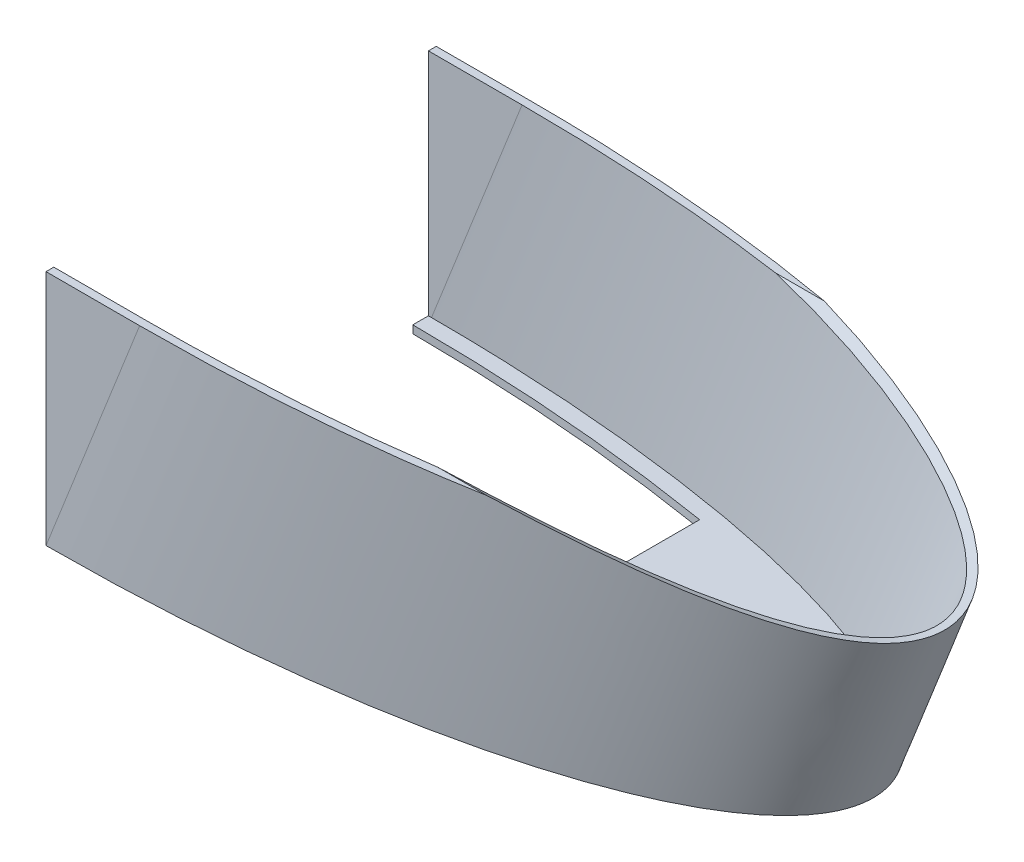
from build123d import *

# Parameters (mm, degrees)
BOSS_EXTRUDE1_DEPTH                               = 1.5875
BOSS_EXTRUDE3_DEPTH                               = 1.5875
SKETCH8_R                                         = 57.15
CUT_EXTRUDE2_DEPTH                                = 332.381489744
CSK_FOR_6_FLAT_HEAD_SOCKET_CAP_SCREW1_D           = 3.7973
CSK_FOR_6_FLAT_HEAD_SOCKET_CAP_SCREW1_DEPTH       = 25.4
CSK_FOR_6_FLAT_HEAD_SOCKET_CAP_SCREW1_CSINK_D     = 7.7978
CSK_FOR_6_FLAT_HEAD_SOCKET_CAP_SCREW1_CSINK_ANGLE = 82
CSK_FOR_6_FLAT_HEAD_SOCKET_CAP_SCREW1_TIP         = 1.140824014


with BuildPart() as part:
    # Sketch2 → Boss-Extrude1 (new body)
    with BuildSketch(Plane(origin=(0, 0, 0), x_dir=(1, 0, 0), z_dir=(0, 1, 0))):
        with BuildLine():
            Line((177.8, 39.6875), (177.8, 34.925))
            ThreePointArc((177.8, 34.925), (209.65434478, 33.634789273), (241.3, 29.772609736))
            Line((241.3, 29.772609736), (241.3, -29.772609736))
            ThreePointArc((241.3, -29.772609736), (209.65434478, -33.634789273), (177.8, -34.925))
            Line((177.8, -34.925), (177.8, -39.6875))
            add(Edge.make_bspline(
                [(177.8, -39.6875), (186.143301052, -39.6875), (194.486387917, -39.441008444), (210.855681467, -38.464191965), (218.88146348, -37.733902814), (234.311655445, -35.816484379), (241.715649009, -34.629439064), (255.6232166, -31.841617193), (262.126380598, -30.241021205), (273.99107136, -26.681613977), (279.352224254, -24.723261918), (288.741511951, -20.507643295), (292.76990648, -18.251659724), (299.357876202, -13.480229969), (301.923000051, -10.964368167), (304.562730244, -6.983122211), (305.240156115, -5.62041101), (306.153353808, -2.838855477), (306.3875, -1.419988971), (306.3875, 1.419988971), (306.153353808, 2.838855477), (305.240156115, 5.62041101), (304.562730244, 6.983122211), (301.923000051, 10.964368167), (299.357876202, 13.480229969), (292.76990648, 18.251659724), (288.741511951, 20.507643295), (279.352224254, 24.723261918), (273.99107136, 26.681613977), (262.126380598, 30.241021205), (255.6232166, 31.841617193), (241.715649009, 34.629439064), (234.311655445, 35.816484379), (218.88146348, 37.733902814), (210.855681467, 38.464191965), (194.486387917, 39.441008444), (186.143301052, 39.6875), (177.8, 39.6875)],
                knots=[0, 0, 0, 0, 0.0625, 0.0625, 0.125, 0.125, 0.1875, 0.1875, 0.25, 0.25, 0.3125, 0.3125, 0.375, 0.375, 0.4375, 0.4375, 0.46875, 0.46875, 0.5, 0.5, 0.53125, 0.53125, 0.5625, 0.5625, 0.625, 0.625, 0.6875, 0.6875, 0.75, 0.75, 0.8125, 0.8125, 0.875, 0.875, 0.9375, 0.9375, 1, 1, 1, 1], degree=3))
        make_face()
    extrude(amount=BOSS_EXTRUDE1_DEPTH)

    # Sweep1: sweep along a path in Sketch5
    with BuildLine(Plane.XY) as sweep1_path:
        Line((306.3875, 0), (325.4375, 48.26))
    # Sketch4 → Sweep1 (sweep)
    with BuildSketch(Plane(origin=(0, 0, 0), x_dir=(1, 0, 0), z_dir=(0, 1, 0))):
        with BuildLine():
            Line((177.8, 38.1), (177.8, 39.6875))
            add(Edge.make_bspline(
                [(177.8, -39.6875), (186.143301052, -39.6875), (194.486387917, -39.441008444), (210.855681467, -38.464191965), (218.88146348, -37.733902814), (234.311655445, -35.816484379), (241.715649009, -34.629439064), (255.6232166, -31.841617193), (262.126380598, -30.241021205), (273.99107136, -26.681613977), (279.352224254, -24.723261918), (288.741511951, -20.507643295), (292.76990648, -18.251659724), (299.357876202, -13.480229969), (301.923000051, -10.964368167), (304.562730244, -6.983122211), (305.240156115, -5.62041101), (306.153353808, -2.838855477), (306.3875, -1.419988971), (306.3875, 1.419988971), (306.153353808, 2.838855477), (305.240156115, 5.62041101), (304.562730244, 6.983122211), (301.923000051, 10.964368167), (299.357876202, 13.480229969), (292.76990648, 18.251659724), (288.741511951, 20.507643295), (279.352224254, 24.723261918), (273.99107136, 26.681613977), (262.126380598, 30.241021205), (255.6232166, 31.841617193), (241.715649009, 34.629439064), (234.311655445, 35.816484379), (218.88146348, 37.733902814), (210.855681467, 38.464191965), (194.486387917, 39.441008444), (186.143301052, 39.6875), (177.8, 39.6875)],
                knots=[0, 0, 0, 0, 0.0625, 0.0625, 0.125, 0.125, 0.1875, 0.1875, 0.25, 0.25, 0.3125, 0.3125, 0.375, 0.375, 0.4375, 0.4375, 0.46875, 0.46875, 0.5, 0.5, 0.53125, 0.53125, 0.5625, 0.5625, 0.625, 0.625, 0.6875, 0.6875, 0.75, 0.75, 0.8125, 0.8125, 0.875, 0.875, 0.9375, 0.9375, 1, 1, 1, 1], degree=3))
            Line((177.8, -39.6875), (177.8, -38.1))
            add(Edge.make_bspline(
                [(177.8, -38.1), (304.8, -38.1), (304.8, 0), (304.8, 38.1), (177.8, 38.1)],
                knots=[1.570796327, 1.570796327, 1.570796327, 3.141592654, 3.141592654, 4.71238898, 4.71238898, 4.71238898], degree=2, weights=[1, 0.707106781, 1, 0.707106781, 1]))
        make_face()
    sweep(path=sweep1_path.line)

    # Sketch7 → Boss-Extrude3 (add)
    with BuildSketch(Plane.XY.offset(-38.1)):
        Polygon((177.8, 0), (196.85, 48.26), (177.8, 48.26), align=None)
    boss_extrude3 = extrude(amount=-BOSS_EXTRUDE3_DEPTH)

    # Mirror2: Boss-Extrude3 across plane
    add(boss_extrude3.mirror(Plane.XY))

    # Sketch8 → Cut-Extrude2 (cut, through all)
    with BuildSketch(Plane(origin=(0, 0, 0), x_dir=(0, 0, -1), z_dir=(1, 0, 0))):
        with Locations((0, 93.98)):
            Circle(SKETCH8_R)
    extrude(amount=CUT_EXTRUDE2_DEPTH, mode=Mode.SUBTRACT)

    # CSK for #6 Flat Head Socket Cap Screw1
    with Locations(Plane(origin=(0, 0, 0), x_dir=(-1, 0, 0), z_dir=(0, -1, 0))):
        with Locations((-273.05, 0)):
            CounterSinkHole(CSK_FOR_6_FLAT_HEAD_SOCKET_CAP_SCREW1_D / 2, CSK_FOR_6_FLAT_HEAD_SOCKET_CAP_SCREW1_CSINK_D / 2, depth=CSK_FOR_6_FLAT_HEAD_SOCKET_CAP_SCREW1_DEPTH, counter_sink_angle=CSK_FOR_6_FLAT_HEAD_SOCKET_CAP_SCREW1_CSINK_ANGLE)
            with Locations((0, 0, -(CSK_FOR_6_FLAT_HEAD_SOCKET_CAP_SCREW1_DEPTH + CSK_FOR_6_FLAT_HEAD_SOCKET_CAP_SCREW1_TIP / 2))):  # 118° drill point
                Cone(0, CSK_FOR_6_FLAT_HEAD_SOCKET_CAP_SCREW1_D / 2, CSK_FOR_6_FLAT_HEAD_SOCKET_CAP_SCREW1_TIP, mode=Mode.SUBTRACT)


solid = part.part
